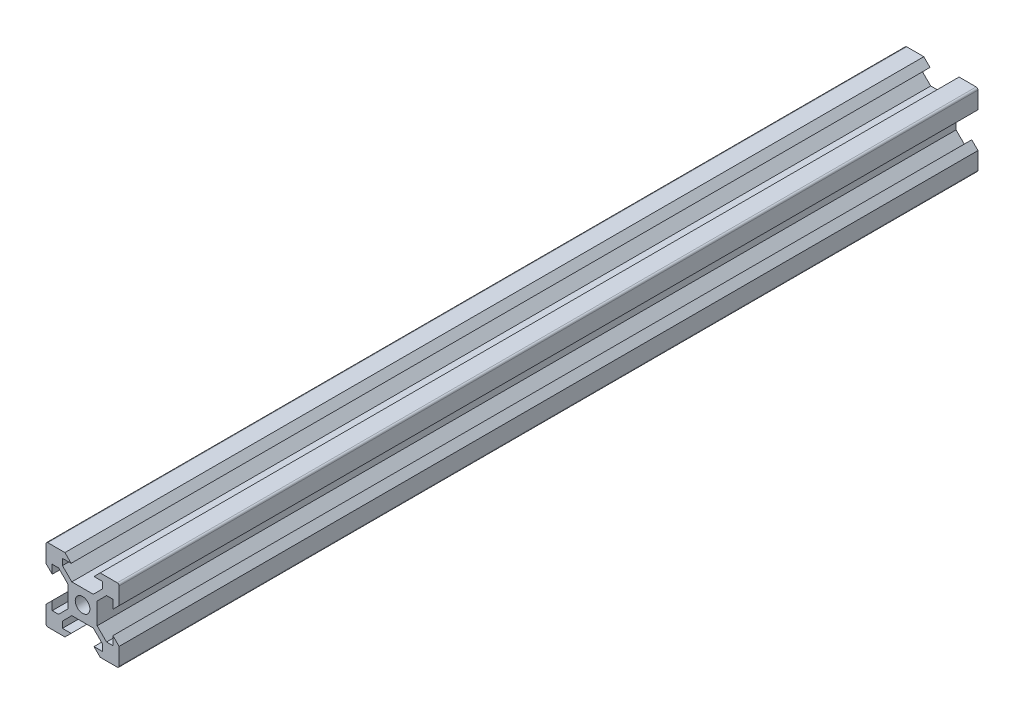
from build123d import *

# Parameters (mm, degrees)
CROQUIS1_R              = 2
SALIENTE_EXTRUIR2_DEPTH = 100
MOVE_FACE_1_BY          = 135


with BuildPart() as part:
    # Croquis1 → Saliente-Extruir2 (new body)
    with BuildSketch(Plane.XY):
        with BuildLine():
            Line((-4.825, 10), (-3.125, 8.3))
            Line((-3.125, 8.3), (-5.5, 8.3))
            Line((-5.5, 8.3), (-5.5, 6.560660172))
            Line((-5.5, 6.560660172), (-2.939339828, 4))
            Line((-2.939339828, 4), (2.939339828, 4))
            Line((2.939339828, 4), (5.5, 6.560660172))
            Line((5.5, 6.560660172), (5.5, 8.3))
            Line((5.5, 8.3), (3.125, 8.3))
            Line((3.125, 8.3), (4.825, 10))
            Line((4.825, 10), (9.5, 10))
            ThreePointArc((9.5, 10), (9.853553391, 9.853553391), (10, 9.5))
            Line((10, 9.5), (10, 4.825))
            Line((10, 4.825), (8.3, 3.125))
            Line((8.3, 3.125), (8.3, 5.5))
            Line((8.3, 5.5), (6.560660172, 5.5))
            Line((6.560660172, 5.5), (4, 2.939339828))
            Line((4, 2.939339828), (4, -2.939339828))
            Line((4, -2.939339828), (6.560660172, -5.5))
            Line((6.560660172, -5.5), (8.3, -5.5))
            Line((8.3, -5.5), (8.3, -3.125))
            Line((8.3, -3.125), (10, -4.825))
            Line((10, -4.825), (10, -9.5))
            ThreePointArc((10, -9.5), (9.853553391, -9.853553391), (9.5, -10))
            Line((9.5, -10), (4.825, -10))
            Line((4.825, -10), (3.125, -8.3))
            Line((3.125, -8.3), (5.5, -8.3))
            Line((5.5, -8.3), (5.5, -6.560660172))
            Line((5.5, -6.560660172), (2.939339828, -4))
            Line((2.939339828, -4), (-2.939339828, -4))
            Line((-2.939339828, -4), (-5.5, -6.560660172))
            Line((-5.5, -6.560660172), (-5.5, -8.3))
            Line((-5.5, -8.3), (-3.125, -8.3))
            Line((-3.125, -8.3), (-4.825, -10))
            Line((-4.825, -10), (-9.5, -10))
            ThreePointArc((-9.5, -10), (-9.853553391, -9.853553391), (-10, -9.5))
            Line((-10, -9.5), (-10, -4.825))
            Line((-10, -4.825), (-8.3, -3.125))
            Line((-8.3, -3.125), (-8.3, -5.5))
            Line((-8.3, -5.5), (-6.560660172, -5.5))
            Line((-6.560660172, -5.5), (-4, -2.939339828))
            Line((-4, -2.939339828), (-4, 2.939339828))
            Line((-4, 2.939339828), (-6.560660172, 5.5))
            Line((-6.560660172, 5.5), (-8.3, 5.5))
            Line((-8.3, 5.5), (-8.3, 3.125))
            Line((-8.3, 3.125), (-10, 4.825))
            Line((-10, 4.825), (-10, 9.5))
            ThreePointArc((-10, 9.5), (-9.853553391, 9.853553391), (-9.5, 10))
            Line((-9.5, 10), (-4.825, 10))
        make_face()
        Circle(CROQUIS1_R, mode=Mode.SUBTRACT)
    extrude(amount=SALIENTE_EXTRUIR2_DEPTH)

    # Move Face 1: a face moved outward by 135.0
    extrude(part.faces().sort_by_distance((5, -5, 0))[0], amount=MOVE_FACE_1_BY, dir=(0, 0, -1))


solid = part.part
